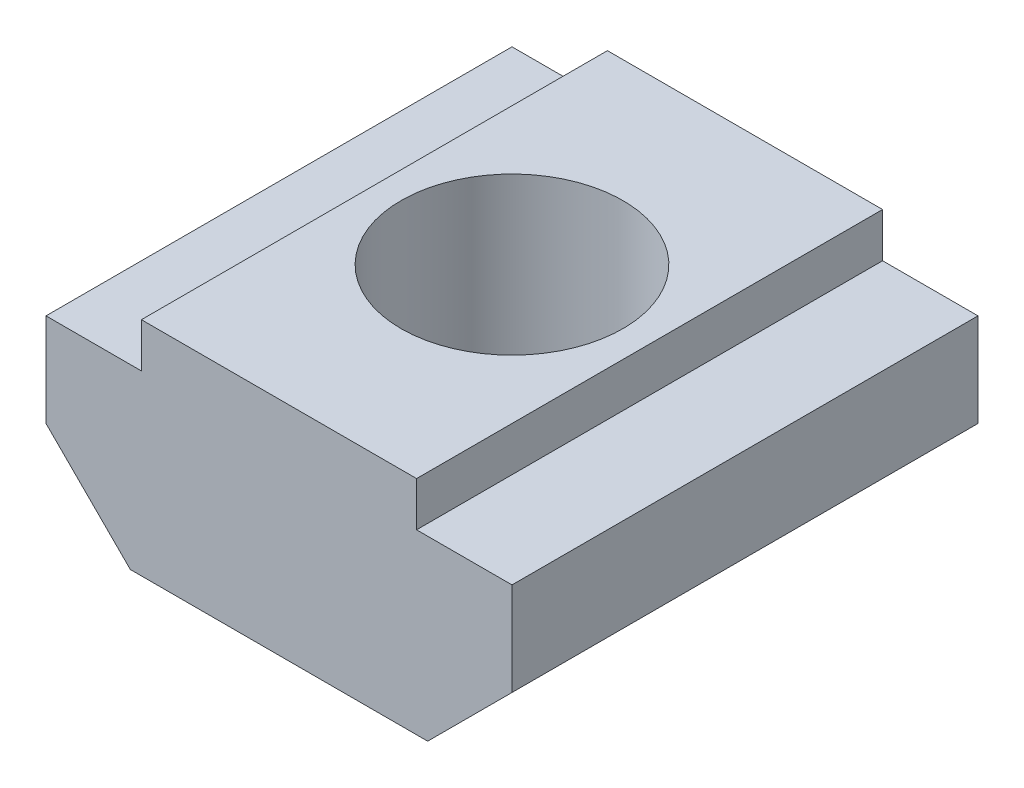
from build123d import *

# Parameters (mm, degrees)
SKETCH2_W           = 6.2
SKETCH2_H           = 1
BOSS_EXTRUDE1_DEPTH = 10.5
CUT_EXTRUDE1_DEPTH  = 13.759800155


with BuildPart() as part:
    # Sketch2 → Boss-Extrude1 (new body)
    with BuildSketch(Plane.XY):
        Polygon((-3.1, 1.5), (-5.25, 1.5), (-5.25, -0.6), (-3.35, -2.5), (3.35, -2.5), (5.25, -0.6), (5.25, 1.5), (3.1, 1.5), align=None)
        with Locations((0, 2)):
            Rectangle(SKETCH2_W, SKETCH2_H)
    extrude(amount=BOSS_EXTRUDE1_DEPTH)

    # Sketch3 → Cut-Extrude1 (cut, through all)
    with BuildSketch(Plane(origin=(0, 2.5, 0), x_dir=(1, 0, 0), z_dir=(0, 1, 0))):
        with BuildLine():
            ThreePointArc((2.5, -5.25), (1.239388718, -3.078844638), (-1.271132484, -3.097275631))
            Line((-1.271132484, -3.097275631), (1.271132484, -7.402724369))
            ThreePointArc((1.271132484, -7.402724369), (2.171155362, -6.489388718), (2.5, -5.25))
        make_face()
        with BuildLine():
            Line((1.271132484, -7.402724369), (-1.271132484, -3.097275631))
            ThreePointArc((-1.271132484, -3.097275631), (-2.152724369, -6.521132484), (1.271132484, -7.402724369))
        make_face()
    extrude(amount=-CUT_EXTRUDE1_DEPTH, mode=Mode.SUBTRACT)


solid = part.part
